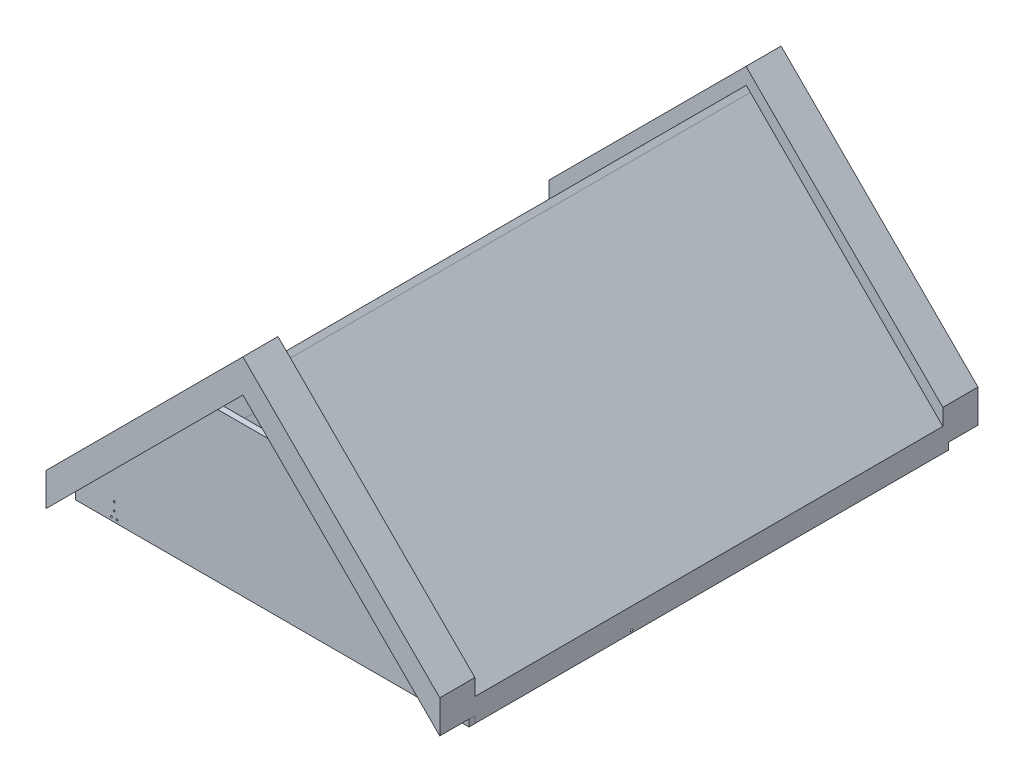
from build123d import *

# Parameters (mm, degrees)
BOSS_EXTRUDE1_DEPTH      = 2000
SHELL1_T                 = -10
SKETCH3_W                = 150
SKETCH3_H                = 1096.015510839
BOSS_EXTRUDE2_DEPTH      = 100
SKETCH7_W                = 150
SKETCH7_H                = 1089.949493661
BOSS_EXTRUDE4_DEPTH      = 100
CUT_EXTRUDE1_DEPTH       = 6
CUT_EXTRUDE1_DEPTH_BACK  = 6.066017
SKETCH8_W                = 150
SKETCH8_H                = 100
SKETCH9_W                = 150
SKETCH9_H                = 100
BOSS_EXTRUDE5_DEPTH      = 239.05
SKETCH10_W               = 150
SKETCH10_H               = 100
BOSS_EXTRUDE6_DEPTH      = 399.5
CUT_EXTRUDE4_DEPTH       = 1197.5
SKETCH14_W               = 2000
SKETCH14_H               = 100
BOSS_EXTRUDE7_DEPTH      = 25
SKETCH15_W               = 2000
SKETCH15_H               = 100
BOSS_EXTRUDE8_DEPTH      = 25
SKETCH16_W               = 2000
SKETCH16_H               = 25
BOSS_EXTRUDE9_DEPTH      = 1436
SKETCH17_W               = 25
SKETCH17_H               = 2000
BOSS_EXTRUDE10_DEPTH     = 1436
CUT_EXTRUDE11_DEPTH      = 1286
CUT_EXTRUDE12_DEPTH      = 1286
BOSS_EXTRUDE13_DEPTH     = 50
BOSS_EXTRUDE14_DEPTH     = 50
BOSS_EXTRUDE15_DEPTH     = 50
BOSS_EXTRUDE16_DEPTH     = 50
BOSS_EXTRUDE17_DEPTH     = 50
BOSS_EXTRUDE18_DEPTH     = 50
BOSS_EXTRUDE19_DEPTH     = 50
BOSS_EXTRUDE20_DEPTH     = 50
SKETCH34_W               = 1400
SKETCH34_H               = 2000
BOSS_EXTRUDE21_DEPTH     = 25
BOSS_EXTRUDE22_DEPTH     = 25
BOSS_EXTRUDE23_DEPTH     = 25
CUT_EXTRUDE16_DEPTH      = 2777.052898712
CUT_EXTRUDE16_DEPTH_BACK = 2777.052898712
SKETCH43_R               = 5
SKETCH45_R               = 4
CUT_EXTRUDE17_DEPTH      = 30


with BuildPart() as part:
    # Sketch1 → Boss-Extrude1 (new body)
    with BuildSketch(Plane.XY):
        Polygon((0, 0), (1400, 0), (700, 700), align=None)
    extrude(amount=BOSS_EXTRUDE1_DEPTH)

    # Shell1
    shell1_openings = [part.faces().sort_by_distance(p)[0] for p in [
        (700, 0, 1000),
    ]]
    offset(amount=SHELL1_T, openings=shell1_openings, kind=Kind.INTERSECTION)


with BuildPart() as body_2:
    # Sketch3 → Boss-Extrude2 (new body)
    with BuildSketch(Plane(origin=(0, 0, 0), x_dir=(0, 0, 1), z_dir=(-0.7071067811865477, 0.7071067811865475, 0))):
        with Locations((2075, 548.00775542)):
            Rectangle(SKETCH3_W, SKETCH3_H)
    extrude(amount=BOSS_EXTRUDE2_DEPTH)

    # Sketch7 → Boss-Extrude4 (add)
    with BuildSketch(Plane(origin=(700, 700, 0), x_dir=(0, 0, -1), z_dir=(0.7071067811865477, 0.7071067811865475, 0))):
        with Locations((-2075, -444.974746831)):
            Rectangle(SKETCH7_W, SKETCH7_H)
    extrude(amount=BOSS_EXTRUDE4_DEPTH)

    # Sketch8 → Cut-Extrude1 (cut, two sides: drawn at the far end of the back side and taken through both)
    with BuildSketch(Plane(origin=(775, 775, 0), x_dir=(0, 0, -1), z_dir=(0.7071067811865476, 0.7071067811865476, 0)).offset(-CUT_EXTRUDE1_DEPTH_BACK)):
        with Locations((-2075, 50)):
            Rectangle(SKETCH8_W, SKETCH8_H)
    extrude(amount=CUT_EXTRUDE1_DEPTH + CUT_EXTRUDE1_DEPTH_BACK, mode=Mode.SUBTRACT)

    # Sketch9 → Boss-Extrude5 (add)
    with BuildSketch(Plane(origin=(0, 0, 0), x_dir=(0, 0, 1), z_dir=(-0.7071067811865476, -0.7071067811865476, 0))):
        with Locations((2075, 50)):
            Rectangle(SKETCH9_W, SKETCH9_H)
    extrude(amount=BOSS_EXTRUDE5_DEPTH)

    # Sketch10 → Boss-Extrude6 (add)
    with BuildSketch(Plane(origin=(700, -700, 0), x_dir=(0, 0, -1), z_dir=(0.7071067811865476, -0.7071067811865476, 0))):
        with Locations((-2075, 1039.949493661)):
            Rectangle(SKETCH10_W, SKETCH10_H)
    extrude(amount=BOSS_EXTRUDE6_DEPTH)

    # Sketch13 → Cut-Extrude4 (cut)
    with BuildSketch(Plane.XY.offset(2150)):
        Polygon((-141.421356237, 0), (-141.421356237, -141.421356237), (-169.033876043, -169.033876043), (-239.744554161, -98.323197924), align=None)
        Polygon((1541.421356237, 0), (1753.199837203, -211.778480965), (1682.489159084, -282.489159084), (1541.244579542, -141.244579542), align=None)
    extrude(amount=-CUT_EXTRUDE4_DEPTH, mode=Mode.SUBTRACT)


with BuildPart() as body_3:
    # Mirror4: mirrored copy
    add(body_2.part.mirror(Plane.XY.offset(1000)))


with BuildPart() as body_2_1:
    add(body_2.part)

    add(body_3.part)  # Boss-Extrude7 merges body 3
    # Sketch14 → Boss-Extrude7 (add)
    with BuildSketch(Plane.ZY.offset(141.421356237)):
        with Locations((1000, -120.710678119)):
            Rectangle(SKETCH14_W, SKETCH14_H)
    extrude(amount=-BOSS_EXTRUDE7_DEPTH)

    # Sketch15 → Boss-Extrude8 (add)
    with BuildSketch(Plane(origin=(1541.418941738, -1.929185159, 0), x_dir=(0, 0, -1), z_dir=(0.999999216794127, -0.001251563475337267, 0))):
        with Locations((-1000, -118.693158413)):
            Rectangle(SKETCH15_W, SKETCH15_H)
    extrude(amount=-BOSS_EXTRUDE8_DEPTH)

    # Sketch16 → Boss-Extrude9 (add)
    with BuildSketch(Plane(origin=(-106.066017178, -106.066017178, 0), x_dir=(0, 0, -1), z_dir=(0.7071067811865483, 0.7071067811865468, 0))):
        with Locations((-1000, 37.5)):
            Rectangle(SKETCH16_W, SKETCH16_H)
    extrude(amount=BOSS_EXTRUDE9_DEPTH)

    # Sketch17 → Boss-Extrude10 (add)
    with BuildSketch(Plane(origin=(804.048443672, -806.063602678, 0), x_dir=(0.7079912163968599, 0.7062212383558673, 0), z_dir=(-0.7062212383558673, 0.7079912163968599, 0))):
        with Locations((1028.875241871, -1000)):
            Rectangle(SKETCH17_W, SKETCH17_H)
    extrude(amount=BOSS_EXTRUDE10_DEPTH)

    # Sketch27 → Cut-Extrude11 (cut)
    with BuildSketch(Plane(origin=(719.584743808, 717.785781949, 0), x_dir=(0, 0, 1), z_dir=(-0.7079912163968599, -0.7062212383558673, 0))):
        Polygon((0, 101.272137447), (0, 51.272098287), (2000, 51.272098287), (2000, 101.272137447), (2000, 297.477961859), (0, 297.477961859), align=None)
    extrude(amount=-CUT_EXTRUDE11_DEPTH, mode=Mode.SUBTRACT)

    # Sketch28 → Cut-Extrude12 (cut)
    with BuildSketch(Plane(origin=(-17.67766953, 17.67766953, 0), x_dir=(0, 0, -1), z_dir=(0.7071067811865468, -0.7071067811865483, 0))):
        Polygon((-2000, 1041.407346594), (0, 1041.407346594), (0, 1089.949493661), (0, 1286), (-2000, 1286), (-2000, 1089.949493661), align=None)
    extrude(amount=-CUT_EXTRUDE12_DEPTH, mode=Mode.SUBTRACT)

    # Sketch29 → Boss-Extrude13 (add)
    with BuildSketch(Plane(origin=(0, 0, 2000), x_dir=(-1, 0, 0), z_dir=(0, 0, -1))):
        Polygon((-701.03084385, 594.964826672), (-1466.590232409, -170.594561887), (-1516.207831122, -170.590922364), (-1516.320027106, -80.946331633), (-701.03084385, 736.386182909), (-630.320165731, 665.67550479), (116.421356237, -81.066017178), (116.421356237, -170.710678119), (64.640862765, -170.706879943), align=None)
    extrude(amount=BOSS_EXTRUDE13_DEPTH)

    # Sketch30 → Boss-Extrude14 (add)
    with BuildSketch(Plane(origin=(0, 0, 1359), x_dir=(-1, 0, 0), z_dir=(0, 0, -1))):
        Polygon((-701.03084385, 736.386182909), (-1516.320027106, -80.946331633), (-1516.207831122, -170.590922364), (-1466.590232409, -170.594561887), (-701.03084385, 594.964826672), (64.640862765, -170.706879943), (116.421356237, -170.710678119), (116.421356237, -81.066017178), align=None)
    extrude(amount=BOSS_EXTRUDE14_DEPTH)

    # Sketch31 → Boss-Extrude15 (add)
    with BuildSketch(Plane(origin=(0, 0, 691), x_dir=(-1, 0, 0), z_dir=(0, 0, -1))):
        Polygon((116.421356237, -81.066017178), (-701.03084385, 736.386182909), (-1516.320027106, -80.946331633), (-1516.207831122, -170.590922364), (-1466.590232409, -170.594561887), (-701.03084385, 594.964826672), (64.640862765, -170.706879943), (116.421356237, -170.710678119), align=None)
    extrude(amount=BOSS_EXTRUDE15_DEPTH)

    # Sketch33 → Boss-Extrude16 (add)
    with BuildSketch(Plane(origin=(0, 0, 50), x_dir=(-1, 0, 0), z_dir=(0, 0, -1))):
        Polygon((116.421356237, -170.710678119), (116.421356237, -81.066017178), (-701.03084385, 736.386182909), (-1516.320027106, -80.946331633), (-1516.207831122, -170.590922364), (-1466.590232409, -170.594561887), (-701.03084385, 594.964826672), (64.640862765, -170.706879943), align=None)
    extrude(amount=BOSS_EXTRUDE16_DEPTH)



with BuildPart() as body_3_2:
    # Sketch35 → Boss-Extrude17 (new body)
    with BuildSketch(Plane.XY.offset(2000)):
        Polygon((1341.704449553, -45.708779031), (60.357238147, -45.708779031), (-39.642761853, -145.708779031), (1441.704449553, -145.708779031), align=None)
    extrude(amount=-BOSS_EXTRUDE17_DEPTH)


with BuildPart() as body_4:
    # Sketch36 → Boss-Extrude18 (new body)
    with BuildSketch(Plane(origin=(0, 0, 1359), x_dir=(-1, 0, 0), z_dir=(0, 0, -1))):
        Polygon((39.642761853, -145.708779031), (-60.357238147, -45.708779031), (-1341.704449553, -45.708779031), (-1441.704449553, -145.708779031), align=None)
    extrude(amount=BOSS_EXTRUDE18_DEPTH)


with BuildPart() as body_5:
    # Sketch37 → Boss-Extrude19 (new body)
    with BuildSketch(Plane(origin=(0, 0, 691), x_dir=(-1, 0, 0), z_dir=(0, 0, -1))):
        Polygon((-1441.704449553, -145.708779031), (39.642761853, -145.708779031), (-60.357238147, -45.708779031), (-1341.704449553, -45.708779031), align=None)
    extrude(amount=BOSS_EXTRUDE19_DEPTH)


with BuildPart() as body_6:
    # Sketch38 → Boss-Extrude20 (new body)
    with BuildSketch(Plane(origin=(0, 0, 50), x_dir=(-1, 0, 0), z_dir=(0, 0, -1))):
        Polygon((-1341.704449553, -45.708779031), (-1441.704449553, -145.708779031), (39.642761853, -145.708779031), (-60.357238147, -45.708779031), align=None)
    extrude(amount=BOSS_EXTRUDE20_DEPTH)


with BuildPart() as body_7:
    # Sketch34 → Boss-Extrude21 (new body)
    with BuildSketch(Plane(origin=(0.012521253, -170.702137522, 0), x_dir=(0.9999999973097808, 7.335147241276342e-05, 0), z_dir=(7.335147241276342e-05, -0.9999999973097808, 0))):
        with Locations((701.018757721, 1000)):
            Rectangle(SKETCH34_W, SKETCH34_H)
    extrude(amount=-BOSS_EXTRUDE21_DEPTH)


with BuildPart() as body_8:
    # Sketch39 → Boss-Extrude22 (new body)
    with BuildSketch(Plane.XY.offset(2000)):
        Polygon((-64.640862765, -170.706879943), (1466.590232409, -170.594561887), (1516.207831122, -170.590922364), (1541.207811542, -170.62221145), (1541.244579542, -141.244579542), (932.5, 467.5), (467.5, 467.5), (-141.421356237, -141.421356237), (-141.421356237, -170.710678119), (-116.421356237, -170.710678119), align=None)
    extrude(amount=BOSS_EXTRUDE22_DEPTH)

    # Sketch45 → Cut-Extrude17 (cut)
    with BuildSketch(Plane.XY.offset(2000)):
        with Locations((13.031645739, -156.202062795)):
            Circle(SKETCH45_R)
        with Locations((37.031645739, -156.202062795)):
            Circle(SKETCH45_R)
        with Locations((25.031645739, -129.202062795)):
            Circle(SKETCH45_R)
        with Locations((25.031645739, -95.202062795)):
            Circle(SKETCH45_R)
        with Locations((1365.031641973, -156.099664126)):
            Circle(SKETCH45_R)
        with Locations((1389.031641973, -156.099664126)):
            Circle(SKETCH45_R)
        with Locations((1377.031641973, -129.099664126)):
            Circle(SKETCH45_R)
        with Locations((1377.031641973, -95.099664126)):
            Circle(SKETCH45_R)
    extrude(amount=CUT_EXTRUDE17_DEPTH, mode=Mode.SUBTRACT)


with BuildPart() as body_2_2:
    add(body_2_1.part)

    add(body_6.part)  # Boss-Extrude23 merges body 6

    add(body_7.part)  # Boss-Extrude23 merges body 7
    # Sketch40 → Boss-Extrude23 (add)
    with BuildSketch(Plane(origin=(0, 0, 0), x_dir=(-1, 0, 0), z_dir=(0, 0, -1))):
        Polygon((-1466.590232409, -170.594561887), (64.640862765, -170.706879943), (116.421356237, -170.710678119), (141.421356237, -170.710678119), (141.421356237, -141.421356237), (-467.5, 467.5), (-932.5, 467.5), (-1541.244579542, -141.244579542), (-1541.207811542, -170.62221145), (-1516.207831122, -170.590922364), align=None)
    extrude(amount=BOSS_EXTRUDE23_DEPTH)

    # Sketch43 → Cut-Extrude16 (cut, two sides: drawn at the far end of the back side and taken through both)
    with BuildSketch(Plane(origin=(0, 0, 0), x_dir=(0, 0, -1), z_dir=(1, 0, 0)).offset(-CUT_EXTRUDE16_DEPTH_BACK)):
        with Locations(Location((-1330, -160.62221145, 0), (0, 0, 270))):
            Circle(SKETCH43_R)
    extrude(amount=CUT_EXTRUDE16_DEPTH + CUT_EXTRUDE16_DEPTH_BACK, mode=Mode.SUBTRACT)


solid = Compound([part.part, body_3_2.part, body_4.part, body_5.part, body_8.part, body_2_2.part])
